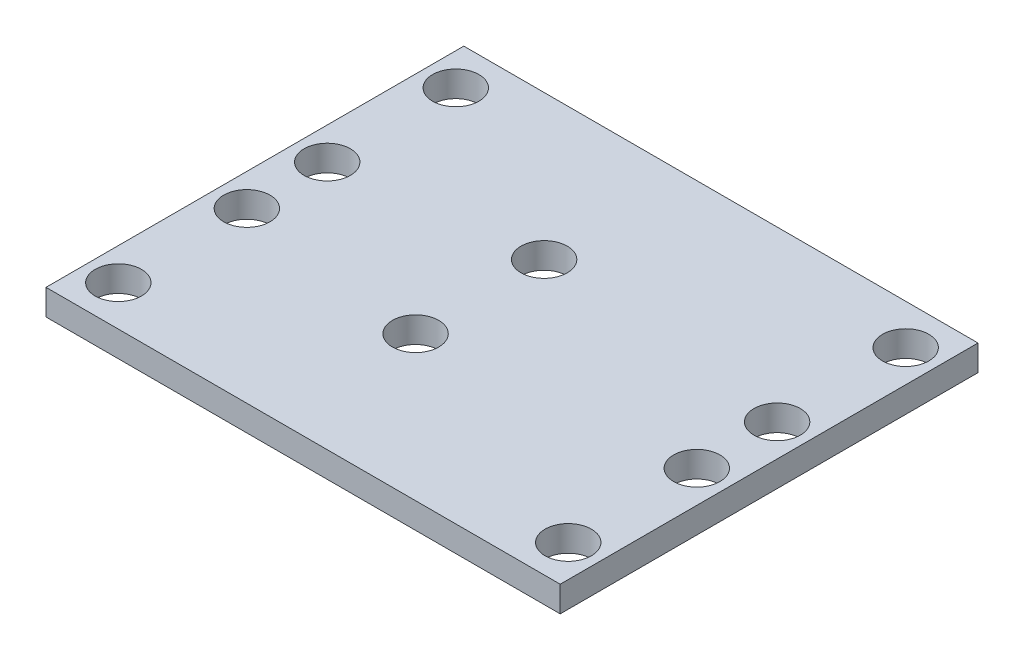
from build123d import *

# Parameters (mm, degrees)
SKETCH1_R           = 2.286
BOSS_EXTRUDE1_DEPTH = 2.54


with BuildPart() as part:
    # Sketch1 → Boss-Extrude1 (new body)
    with BuildSketch(Plane(origin=(0, 0, 0), x_dir=(1, 0, 0), z_dir=(0, 1, 0))):
        Polygon((-25.4, -14.2875), (-25.4, -26.9875), (25.4, -26.9875), (25.4, -14.2875), (25.4, 14.2875), (-25.4, 14.2875), align=None)
        with Locations(Location((-22.225, 10.31875, 0), (0, 0, 270))):
            Circle(SKETCH1_R, mode=Mode.SUBTRACT)
        with Locations(Location((-22.225, -10.31875, 0), (0, 0, 270))):
            Circle(SKETCH1_R, mode=Mode.SUBTRACT)
        with Locations(Location((22.225, -10.31875, 0), (0, 0, 270))):
            Circle(SKETCH1_R, mode=Mode.SUBTRACT)
        with Locations(Location((22.225, 10.31875, 0), (0, 0, 270))):
            Circle(SKETCH1_R, mode=Mode.SUBTRACT)
        with Locations(Location((-22.225, -2.38125, 0), (0, 0, 270))):
            Circle(SKETCH1_R, mode=Mode.SUBTRACT)
        with Locations(Location((-22.225, -23.01875, 0), (0, 0, 270))):
            Circle(SKETCH1_R, mode=Mode.SUBTRACT)
        with Locations(Location((22.225, -23.01875, 0), (0, 0, 270))):
            Circle(SKETCH1_R, mode=Mode.SUBTRACT)
        with Locations(Location((22.225, -2.38125, 0), (0, 0, 270))):
            Circle(SKETCH1_R, mode=Mode.SUBTRACT)
        with Locations(Location((-3.175, 0, 0), (0, 0, 270))):
            Circle(SKETCH1_R, mode=Mode.SUBTRACT)
        with Locations(Location((-3.175, -12.7, 0), (0, 0, 270))):
            Circle(SKETCH1_R, mode=Mode.SUBTRACT)
    extrude(amount=BOSS_EXTRUDE1_DEPTH)


solid = part.part
